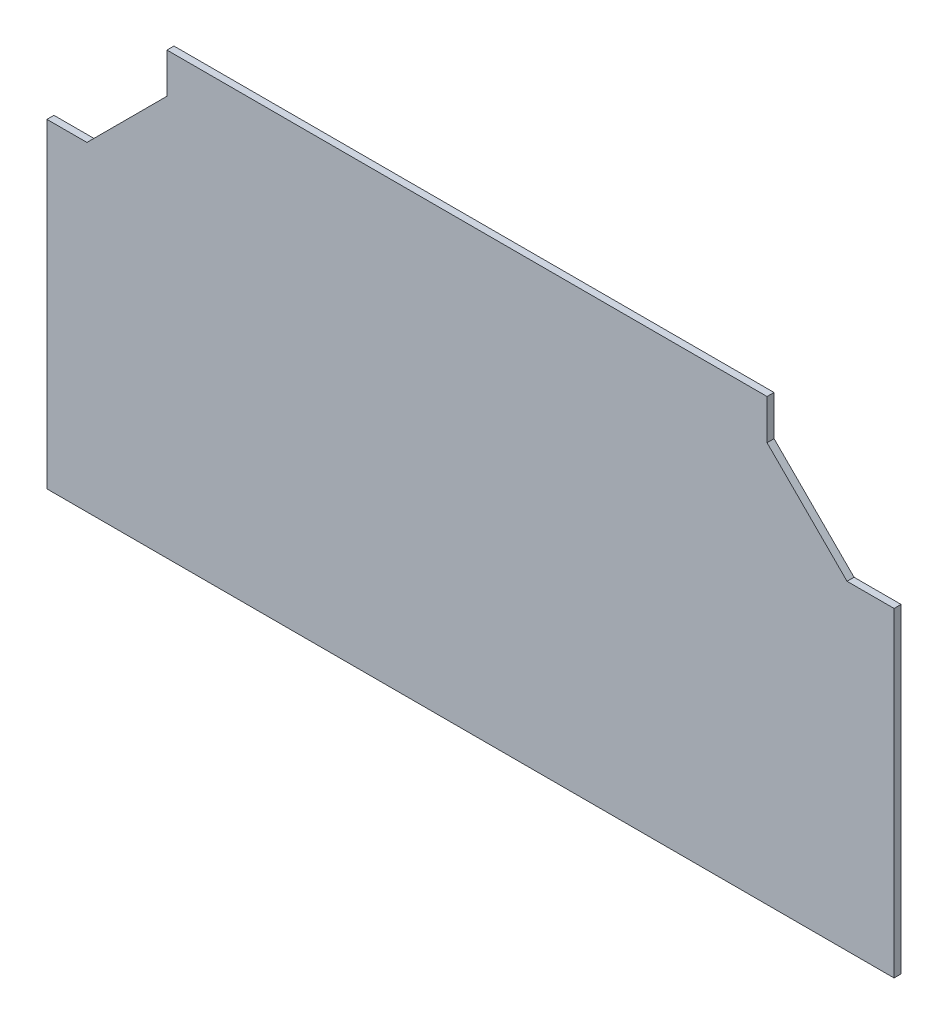
from build123d import *

# Parameters (mm, degrees)
BOSS_EXTRUDE1_DEPTH = 3.5


with BuildPart() as part:
    # Sketch1 → Boss-Extrude1 (new body)
    with BuildSketch(Plane.XY):
        Polygon((60, 0), (60, -20), (20, -60), (0, -60), (0, -220), (423.5, -220), (423.5, -60), (400, -60), (360, -20), (360, 0), align=None)
    extrude(amount=BOSS_EXTRUDE1_DEPTH)


solid = part.part
